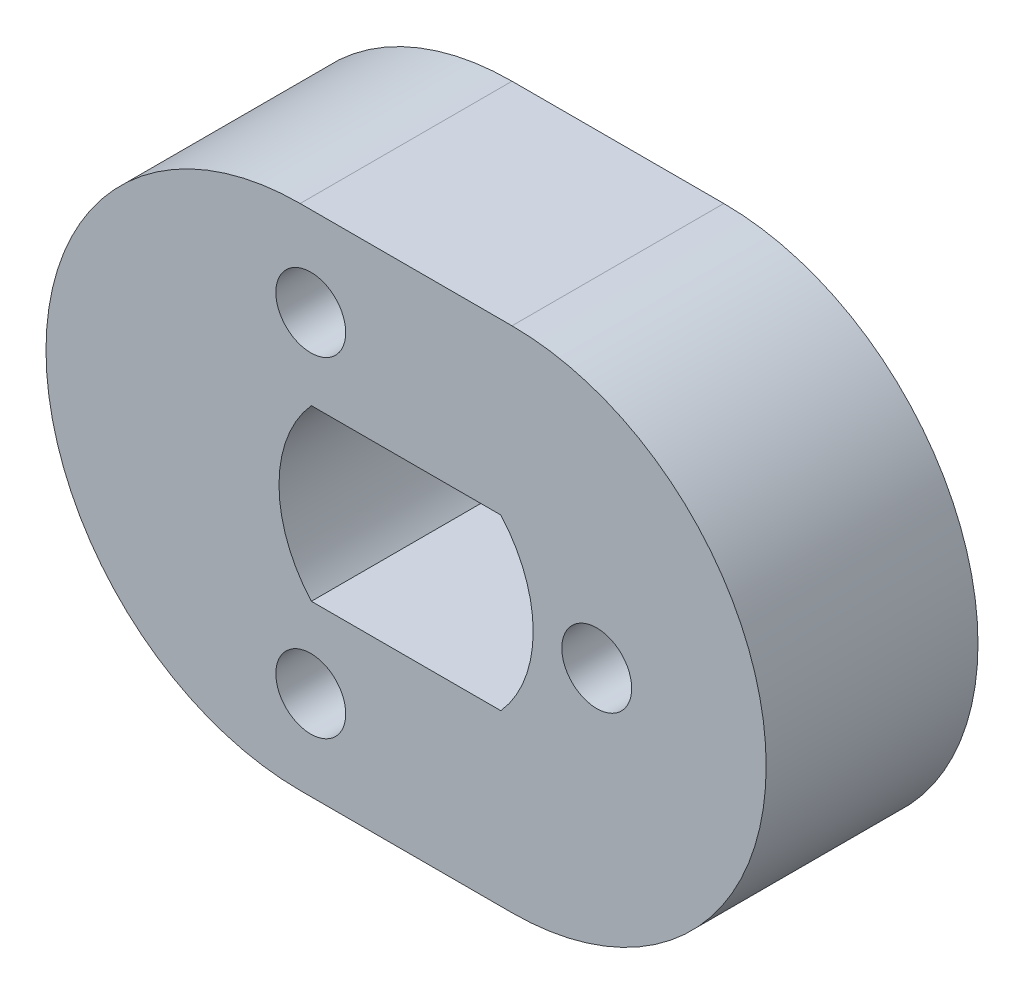
from build123d import *

# Parameters (mm, degrees)
SKETCH1_R           = 6
BOSS_EXTRUDE1_DEPTH = 10
M4_TAPPED_HOLE1_D   = 3.3
CIRPATTERN1_COUNT   = 3
BOSS_EXTRUDE2_START = -10
BOSS_EXTRUDE2_DEPTH = 10


with BuildPart() as part:
    # Sketch1 → Boss-Extrude1 (new body)
    with BuildSketch(Plane.XY):
        with BuildLine():
            Line((0, 12), (10, 12))
            ThreePointArc((10, 12), (22, 0), (10, -12))
            Line((10, -12), (0, -12))
            ThreePointArc((0, -12), (-12, 0), (0, 12))
        make_face()
        with Locations((5, 0)):
            Circle(SKETCH1_R, mode=Mode.SUBTRACT)
    extrude(amount=BOSS_EXTRUDE1_DEPTH)

    # M4 Tapped Hole1 (through all)
    with Locations(Plane(origin=(14, 0, 10), x_dir=(1, 0, 0), z_dir=(0, 0, 1))):
        with Locations((0, 0)):
            m4_tapped_hole1 = Hole(M4_TAPPED_HOLE1_D / 2)

    # CirPattern1: M4 Tapped Hole1 ×3 about axis
    cirpattern1_axis = Axis((5, 0, 0), (0, 0, 1))
    for i in range(1, CIRPATTERN1_COUNT):
        add(m4_tapped_hole1.rotate(cirpattern1_axis, i * 360 / CIRPATTERN1_COUNT), mode=Mode.SUBTRACT)

    # Sketch4 → Boss-Extrude2 (add)
    with BuildSketch(Plane.XY.offset(10).offset(BOSS_EXTRUDE2_START)):
        with BuildLine():
            ThreePointArc((9.472135955, 4), (5, 6), (0.527864045, 4))
            Line((0.527864045, 4), (9.472135955, 4))
        make_face()
        with BuildLine():
            Line((9.472135955, -4), (0.527864045, -4))
            ThreePointArc((0.527864045, -4), (5, -6), (9.472135955, -4))
        make_face()
    extrude(amount=BOSS_EXTRUDE2_DEPTH)


solid = part.part
